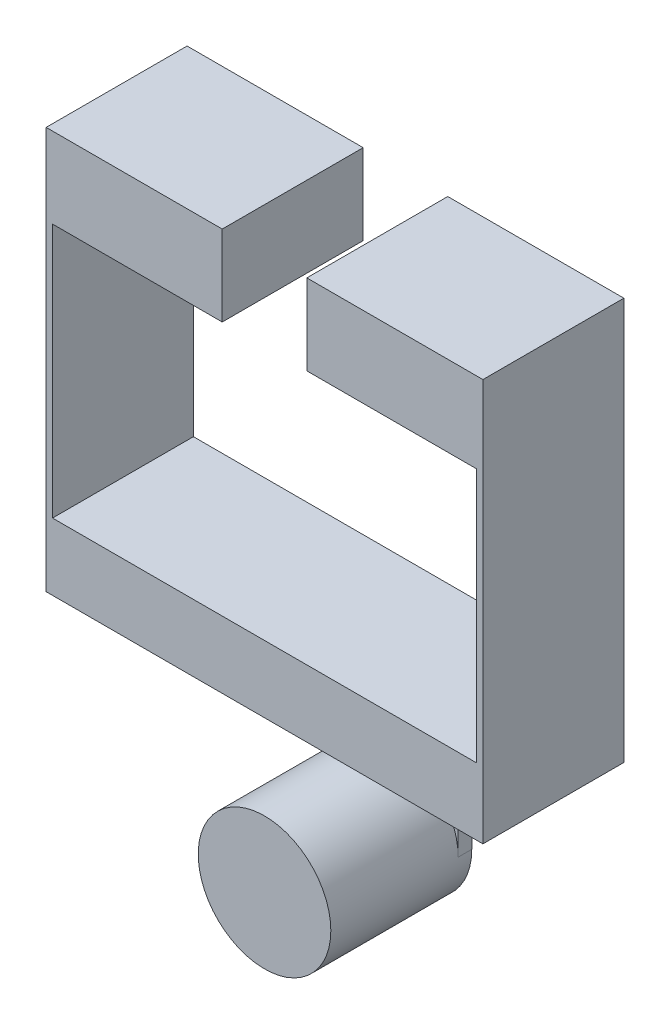
from build123d import *

# Parameters (mm, degrees)
SKETCH1_R           = 9.913174659
BOSS_EXTRUDE1_DEPTH = 21.074744356
SKETCH2_W           = 19.826349318
SKETCH2_H           = 22.613174659
BOSS_EXTRUDE2_DEPTH = 2.024744356
SKETCH3_W           = 63.40856
SKETCH3_H           = 21.074744356
BOSS_EXTRUDE3_DEPTH = 10.014018179
SKETCH4_W           = 0.952402748
SKETCH4_H           = 21.074744356
BOSS_EXTRUDE4_DEPTH = 38.0746
SKETCH5_W           = 0.952402748
SKETCH5_H           = 21.074744356
BOSS_EXTRUDE5_DEPTH = 10.014018179
SKETCH6_W           = 21.074744356
SKETCH6_H           = 12.042842766
BOSS_EXTRUDE6_DEPTH = 25.37968
SKETCH6_3_W         = 21.074744356
SKETCH6_3_H         = 12.042842766
BOSS_EXTRUDE7_DEPTH = 0.952402748


with BuildPart() as part:
    # Sketch1 → Boss-Extrude1 (new body)
    with BuildSketch(Plane.XY):
        Circle(SKETCH1_R)
    extrude(amount=BOSS_EXTRUDE1_DEPTH)

    # Sketch2 → Boss-Extrude2 (add)
    with BuildSketch(Plane(origin=(0, 0, 0), x_dir=(-1, 0, 0), z_dir=(0, 0, -1))):
        with Locations((0, 11.30658733)):
            Rectangle(SKETCH2_W, SKETCH2_H)
    extrude(amount=-BOSS_EXTRUDE2_DEPTH)

    # Sketch3 → Boss-Extrude3 (add)
    with BuildSketch(Plane(origin=(0, 22.613174659, 0), x_dir=(1, 0, 0), z_dir=(0, 1, 0))):
        with Locations((0, -10.537372178)):
            Rectangle(SKETCH3_W, SKETCH3_H)
    extrude(amount=BOSS_EXTRUDE3_DEPTH)



with BuildPart() as body_2:
    # Sketch4 → Boss-Extrude4 (new body)
    with BuildSketch(Plane(origin=(0, 32.627192838, 0), x_dir=(1, 0, 0), z_dir=(0, 1, 0))):
        with Locations((32.180481374, -10.537372178)):
            Rectangle(SKETCH4_W, SKETCH4_H)
    boss_extrude4 = extrude(amount=BOSS_EXTRUDE4_DEPTH)


with BuildPart() as part_1:
    add(part.part)

    add(body_2.part)  # Boss-Extrude5 merges body 2
    # Sketch5 → Boss-Extrude5 (add)
    with BuildSketch(Plane.XZ.offset(-32.627192838)):
        with Locations((32.180481374, 10.537372178)):
            Rectangle(SKETCH5_W, SKETCH5_H)
    boss_extrude5 = extrude(amount=BOSS_EXTRUDE5_DEPTH)



with BuildPart() as body_2_2:
    # Sketch6 → Boss-Extrude6 (new body)
    with BuildSketch(Plane.ZY.offset(-31.70428)):
        with Locations((10.537372178, 76.723214221)):
            Rectangle(SKETCH6_W, SKETCH6_H)
    boss_extrude6 = extrude(amount=BOSS_EXTRUDE6_DEPTH)


with BuildPart() as part_2:
    add(part_1.part)

    add(body_2_2.part)  # Boss-Extrude7 merges body 2 2
    # Sketch6<3> → Boss-Extrude7 (add)
    with BuildSketch(Plane.ZY.offset(-31.70428)):
        with Locations((10.537372178, 76.723214221)):
            Rectangle(SKETCH6_3_W, SKETCH6_3_H)
    boss_extrude7 = extrude(amount=-BOSS_EXTRUDE7_DEPTH)

    # Mirror4: Boss-Extrude5 across plane
    add(boss_extrude5.mirror(Plane(origin=(0, 0, 0), x_dir=(0, 0, 1), z_dir=(1, 0, 0))))

    # Mirror5: Boss-Extrude4 across plane
    add(boss_extrude4.mirror(Plane(origin=(0, 0, 0), x_dir=(0, 0, 1), z_dir=(1, 0, 0))))

    # Mirror8: Boss-Extrude7 across plane
    add(boss_extrude7.mirror(Plane(origin=(0, 0, 0), x_dir=(0, 0, 1), z_dir=(1, 0, 0))))

    # Mirror9: Boss-Extrude6 across plane
    add(boss_extrude6.mirror(Plane(origin=(0, 0, 0), x_dir=(0, 0, 1), z_dir=(1, 0, 0))))


solid = part_2.part
